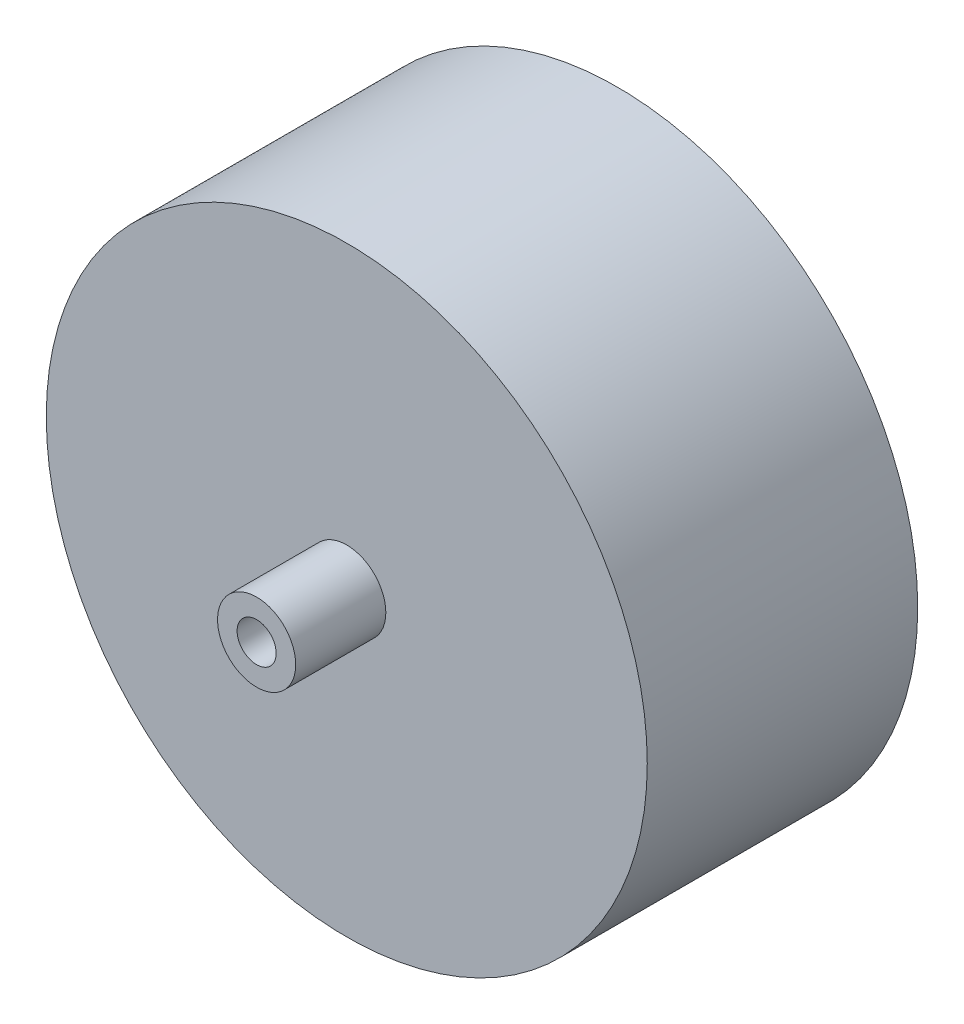
from build123d import *

# Parameters (mm, degrees)
SKETCH1_R           = 50
BOSS_EXTRUDE1_DEPTH = 45
SKETCH2_R           = 6.5
BOSS_EXTRUDE2_DEPTH = 15
SKETCH3_R           = 3.25
CUT_EXTRUDE1_DEPTH  = 13


with BuildPart() as part:
    # Sketch1 → Boss-Extrude1 (new body)
    with BuildSketch(Plane.XY):
        with Locations(Location((0, 0, 0), (0, 0, 180))):
            Circle(SKETCH1_R)
    extrude(amount=BOSS_EXTRUDE1_DEPTH)

    # Sketch2 → Boss-Extrude2 (add)
    with BuildSketch(Plane.XY.offset(45)):
        Circle(SKETCH2_R)
    extrude(amount=BOSS_EXTRUDE2_DEPTH)

    # Sketch3 → Cut-Extrude1 (cut)
    with BuildSketch(Plane.XY.offset(60)):
        Circle(SKETCH3_R)
    extrude(amount=-CUT_EXTRUDE1_DEPTH, mode=Mode.SUBTRACT)


solid = part.part
